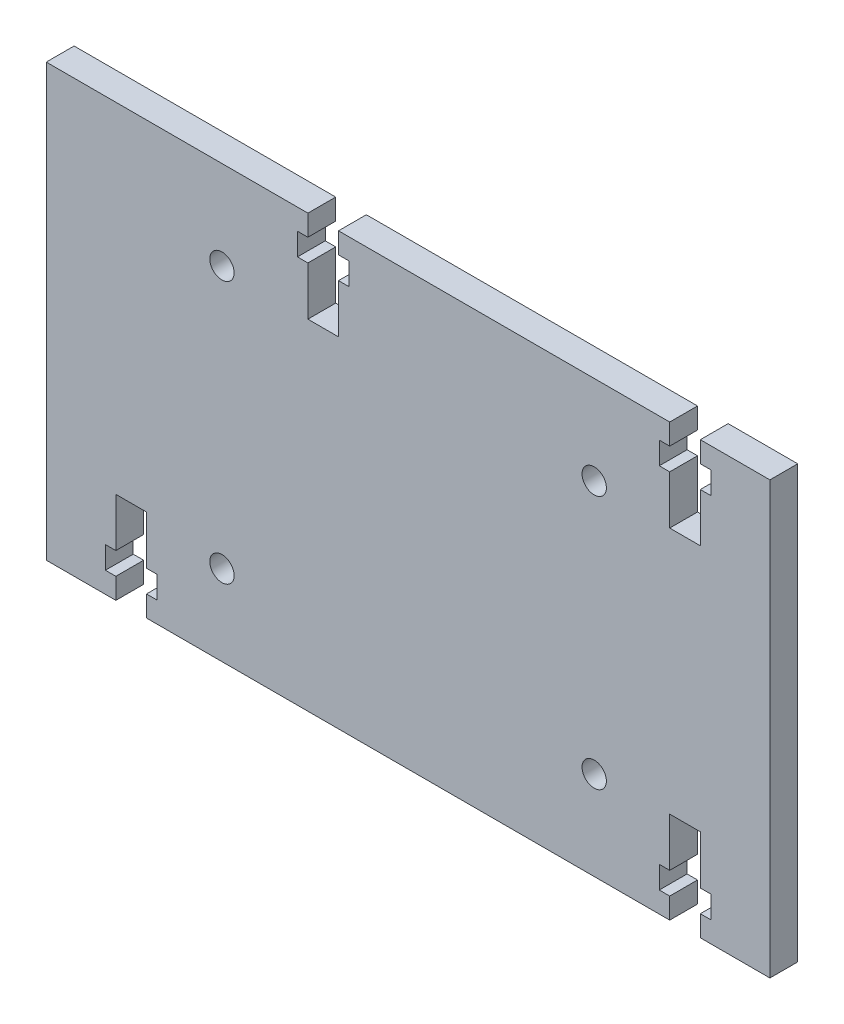
from build123d import *

# Parameters (mm, degrees)
SKETCH1_W           = 104
SKETCH1_H           = 62
BOSS_EXTRUDE1_DEPTH = 4
CUT_EXTRUDE1_DEPTH  = 10
SKETCH4_R           = 1.75
CUT_EXTRUDE3_DEPTH  = 10


with BuildPart() as part:
    # Sketch1 → Boss-Extrude1 (new body)
    with BuildSketch(Plane.XY):
        Rectangle(SKETCH1_W, SKETCH1_H)
    extrude(amount=BOSS_EXTRUDE1_DEPTH)

    # Sketch2 → Cut-Extrude1 (cut)
    with BuildSketch(Plane(origin=(0, 0, 0), x_dir=(-1, 0, 0), z_dir=(0, 0, -1))):
        Polygon((-37.6, -28), (-37.6, -31), (-42, -31), (-42, -28), (-43.5, -28), (-43.5, -24.8), (-42, -24.8), (-42, -17.8), (-37.6, -17.8), (-37.6, -24.8), (-36.1, -24.8), (-36.1, -28), align=None)
        Polygon((42, -31), (42, -28), (43.5, -28), (43.5, -24.8), (42, -24.8), (42, -17.8), (37.6, -17.8), (37.6, -24.8), (36.1, -24.8), (36.1, -28), (37.6, -28), (37.6, -31), align=None)
        Polygon((-42, 31), (-42, 28), (-43.5, 28), (-43.5, 24.8), (-42, 24.8), (-42, 17.8), (-37.6, 17.8), (-37.6, 24.8), (-36.1, 24.8), (-36.1, 28), (-37.6, 28), (-37.6, 31), align=None)
        Polygon((14.4, 24.8), (14.4, 17.8), (10, 17.8), (10, 24.8), (8.5, 24.8), (8.5, 28), (10, 28), (10, 31), (14.4, 31), (14.4, 28), (15.9, 28), (15.9, 24.8), align=None)
    extrude(amount=-CUT_EXTRUDE1_DEPTH, mode=Mode.SUBTRACT)

    # Sketch4 → Cut-Extrude3 (cut)
    with BuildSketch(Plane(origin=(0, 0, 0), x_dir=(-1, 0, 0), z_dir=(0, 0, -1))):
        with Locations((-26.75, 18.25)):
            Circle(SKETCH4_R)
        with Locations((-26.75, -18.25)):
            Circle(SKETCH4_R)
        with Locations((26.75, 18.25)):
            Circle(SKETCH4_R)
        with Locations((26.75, -19.415816569)):
            Circle(SKETCH4_R)
    extrude(amount=-CUT_EXTRUDE3_DEPTH, mode=Mode.SUBTRACT)


solid = part.part
